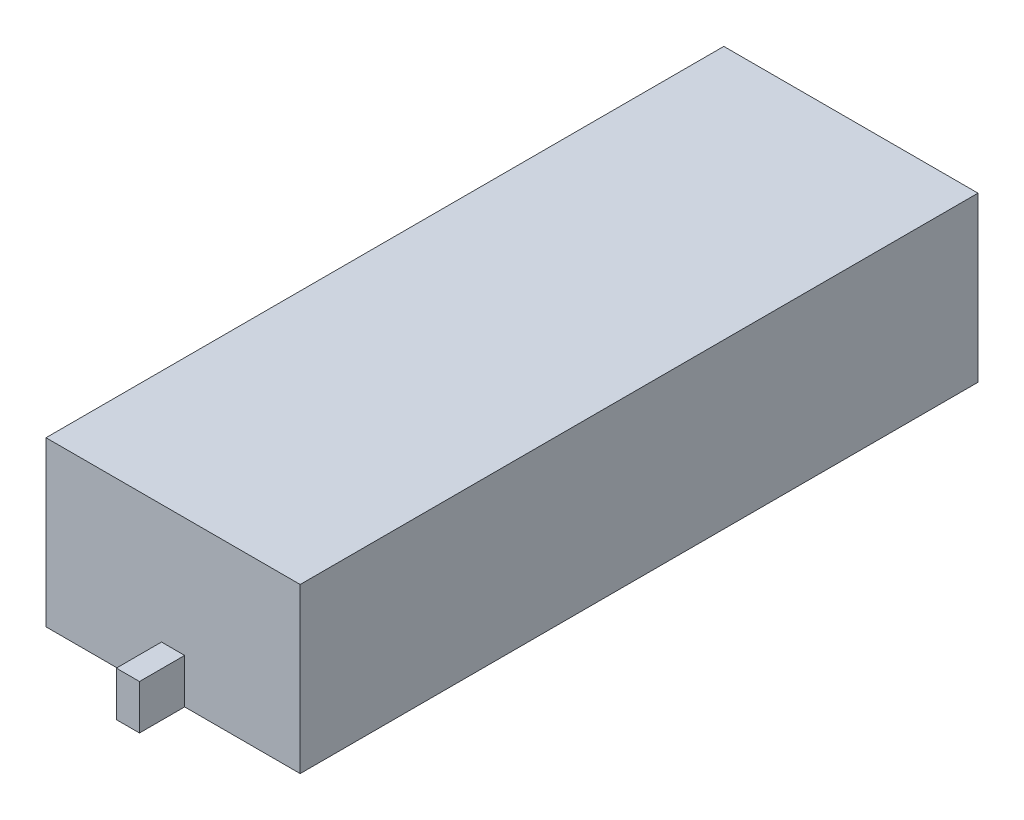
from build123d import *

# Parameters (mm, degrees)
SK_PACK_W     = 90
SK_PACK_H     = 240
EX_PACK_DEPTH = 58
SK_XT60_W     = 8.2
SK_XT60_H     = 16
EX_XT60_DEPTH = 15.8


with BuildPart() as part:
    # SK_Pack → EX_Pack (new body)
    with BuildSketch(Plane(origin=(0, 0, 0), x_dir=(1, 0, 0), z_dir=(0, 1, 0))):
        Rectangle(SK_PACK_W, SK_PACK_H)
    extrude(amount=EX_PACK_DEPTH)

    # SK_XT60 → EX_XT60 (add)
    with BuildSketch(Plane(origin=(0, 0, 0), x_dir=(1, 0, 0), z_dir=(0, 1, 0))):
        with Locations((0, -128)):
            Rectangle(SK_XT60_W, SK_XT60_H)
    extrude(amount=EX_XT60_DEPTH)


solid = part.part
